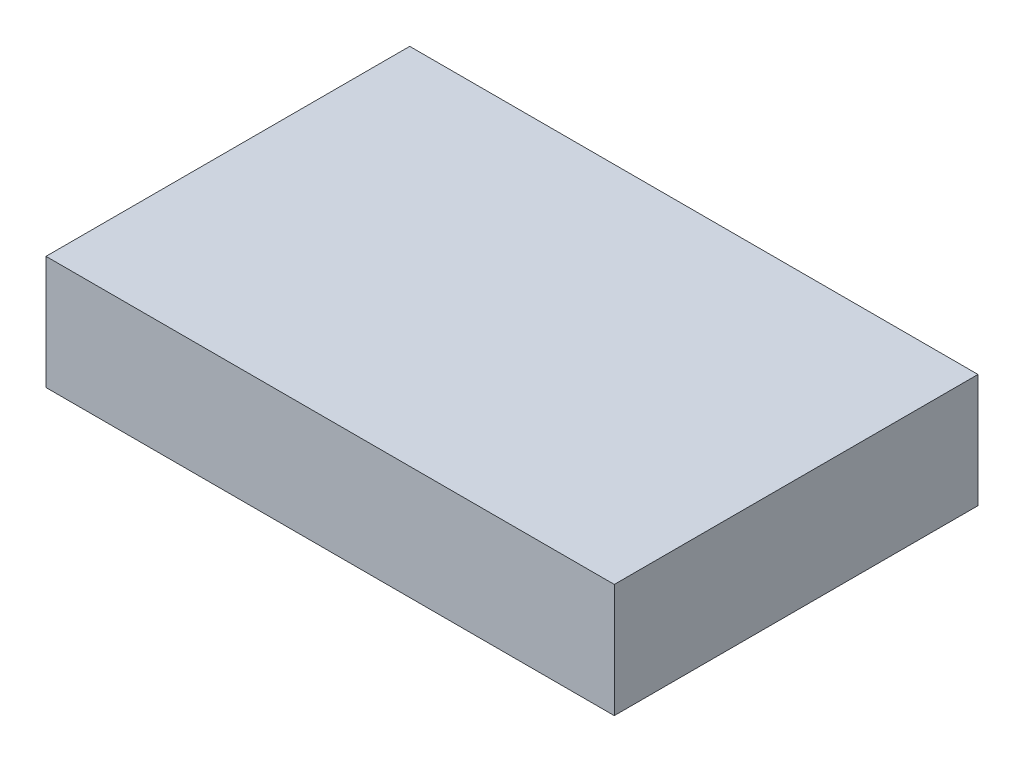
from build123d import *

# Parameters (mm, degrees)
SKETCH1_W           = 5
SKETCH1_H           = 3.2
BOSS_EXTRUDE1_DEPTH = 0.8
SKETCH2_W           = 5
SKETCH2_H           = 3.2
BOSS_EXTRUDE2_DEPTH = 0.2


with BuildPart() as part:
    # Sketch1 → Boss-Extrude1 (new body)
    with BuildSketch(Plane(origin=(0, 0, 0), x_dir=(1, 0, 0), z_dir=(0, 1, 0))):
        with Locations((2.5, 1.6)):
            Rectangle(SKETCH1_W, SKETCH1_H)
    extrude(amount=BOSS_EXTRUDE1_DEPTH)

    # Sketch2 → Boss-Extrude2 (add)
    with BuildSketch(Plane(origin=(0, 0.8, 0), x_dir=(1, 0, 0), z_dir=(0, 1, 0))):
        with Locations((2.5, 1.6)):
            Rectangle(SKETCH2_W, SKETCH2_H)
    extrude(amount=BOSS_EXTRUDE2_DEPTH)


solid = part.part
